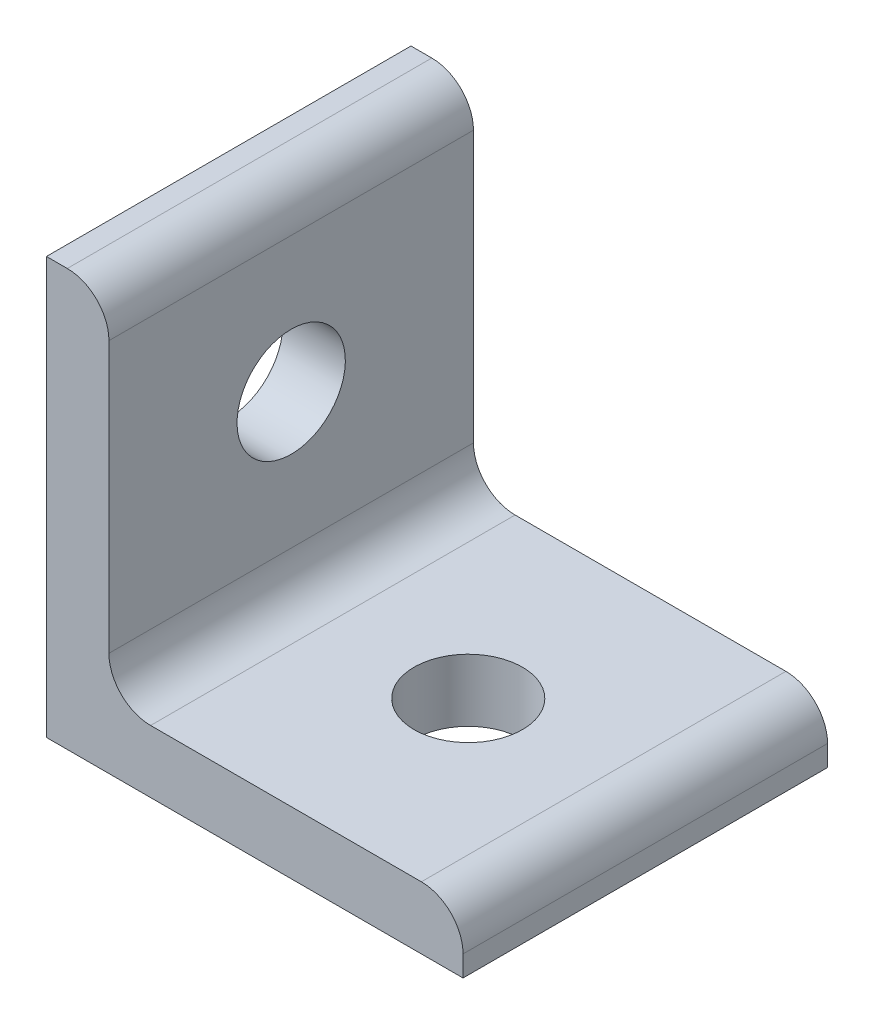
from build123d import *

# Parameters (mm, degrees)
BOSS_EXTRUDE1_DEPTH = 22.225
SKETCH2_R           = 3.302
CUT_EXTRUDE1_DEPTH  = 38.765153581
SKETCH3_R           = 3.302
CUT_EXTRUDE2_DEPTH  = 38.765153581
FILLET1_R           = 2.54


with BuildPart() as part:
    # Sketch1 → Boss-Extrude1 (new body)
    with BuildSketch(Plane.XY):
        Polygon((0, 21.59), (0, 0), (21.59, 0), (21.59, -3.81), (-3.81, -3.81), (-3.81, 21.59), align=None)
    extrude(amount=BOSS_EXTRUDE1_DEPTH)

    # Sketch2 → Cut-Extrude1 (cut, through all)
    with BuildSketch(Plane(origin=(0, 0, 0), x_dir=(1, 0, 0), z_dir=(0, 1, 0))):
        with Locations(Location((10.795, -11.1125, 0), (0, 0, 270))):
            Circle(SKETCH2_R)
    extrude(amount=-CUT_EXTRUDE1_DEPTH, mode=Mode.SUBTRACT)

    # Sketch3 → Cut-Extrude2 (cut, through all)
    with BuildSketch(Plane(origin=(0, 0, 0), x_dir=(0, 0, -1), z_dir=(1, 0, 0))):
        with Locations(Location((-11.1125, 10.795, 0), (0, 0, 90))):
            Circle(SKETCH3_R)
    extrude(amount=-CUT_EXTRUDE2_DEPTH, mode=Mode.SUBTRACT)

    # Fillet1
    fillet1_edges = [part.edges().sort_by_distance(p)[0] for p in [
        (0, 21.59, 11.1125),
        (0, 0, 11.1125),
        (21.59, 0, 11.1125),
    ]]
    fillet(fillet1_edges, radius=FILLET1_R)


solid = part.part
